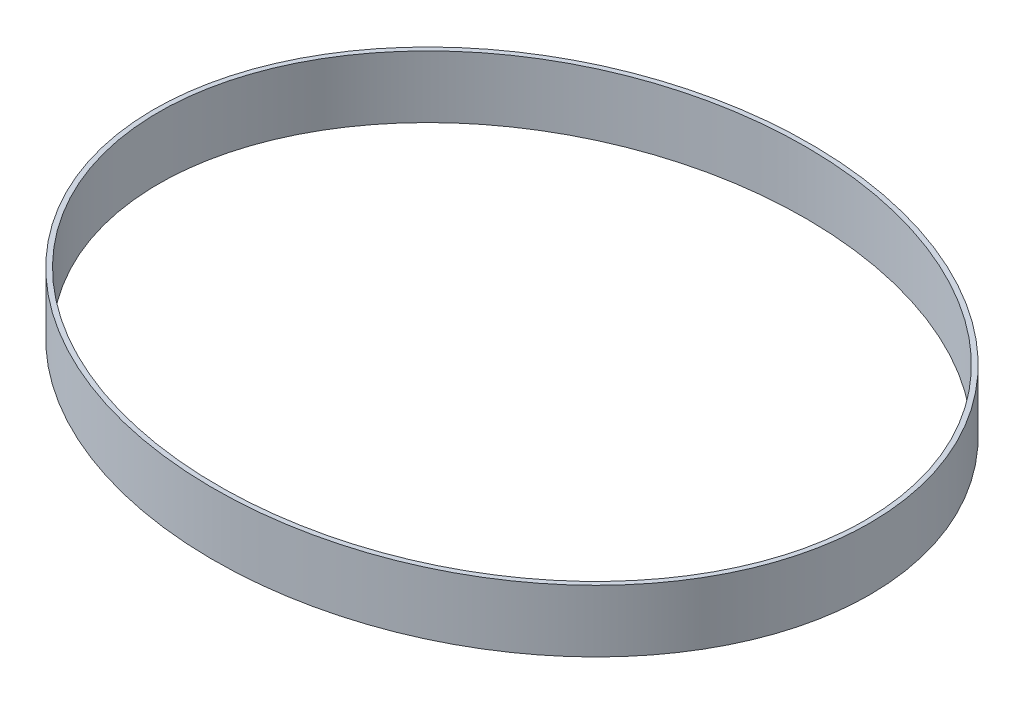
from build123d import *

# Parameters (mm, degrees)
SKETCH1_RX          = 75
SKETCH1_RY          = 62.5
SKETCH1_RX_2        = 74
SKETCH1_RY_2        = 61.5
BOSS_EXTRUDE1_DEPTH = 13


with BuildPart() as part:
    # Sketch1 → Boss-Extrude1 (new body)
    with BuildSketch(Plane(origin=(0, 0, 0), x_dir=(1, 0, 0), z_dir=(0, 1, 0))):
        with Locations((0, 0)):
            Ellipse(SKETCH1_RX, SKETCH1_RY)
        with Locations((0, 0)):
            Ellipse(SKETCH1_RX_2, SKETCH1_RY_2, mode=Mode.SUBTRACT)
    extrude(amount=BOSS_EXTRUDE1_DEPTH)


solid = part.part
